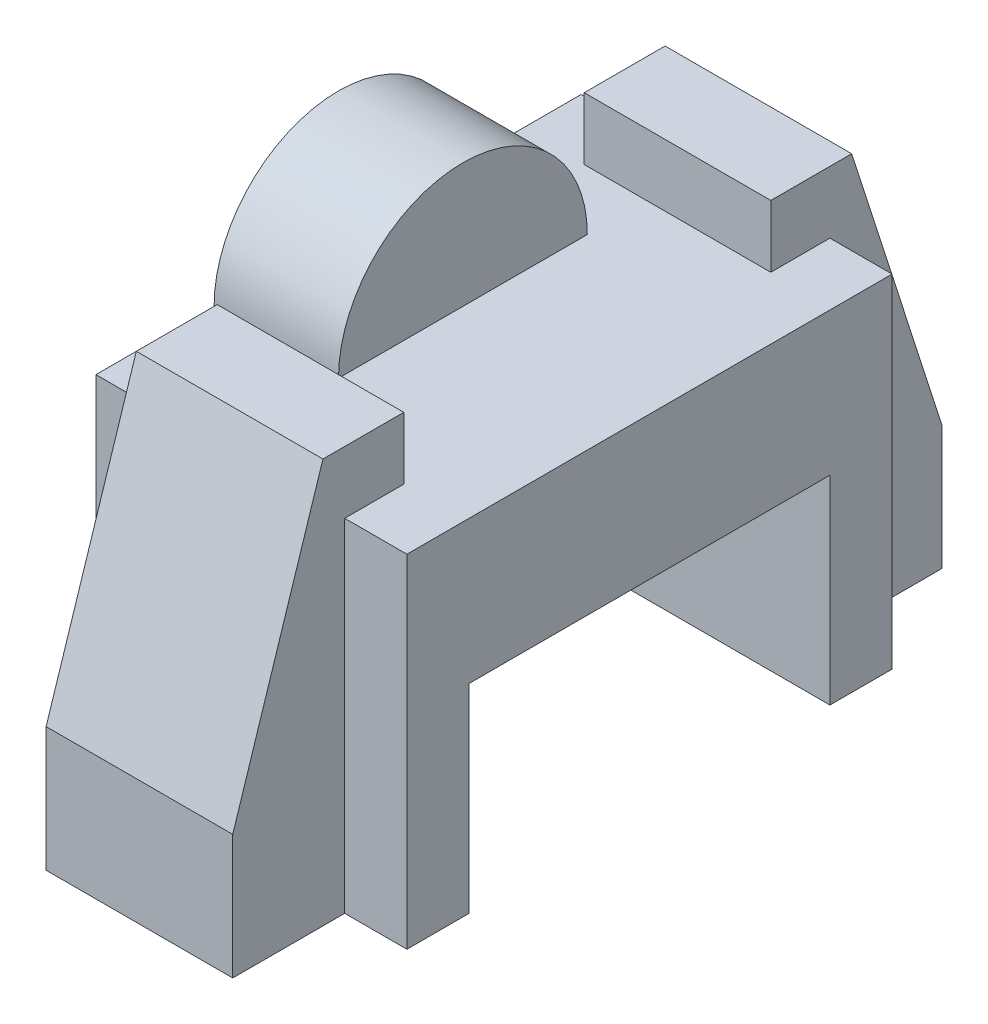
from build123d import *

# Parameters (mm, degrees)
SALIENTE_EXTRUIR2_DEPTH = 25
SALIENTE_EXTRUIR3_DEPTH = 15
SALIENTE_EXTRUIR4_START = -50
SALIENTE_EXTRUIR4_DEPTH = 20


with BuildPart() as part:
    # Croquis1 → Saliente-Extruir2 (new, symmetric)
    with BuildSketch(Plane(origin=(0, 0, 0), x_dir=(0, 0, -1), z_dir=(1, 0, 0))):
        Polygon((29, -27.5), (39, -27.5), (39, 27.5), (-39, 27.5), (-39, -27.5), (-29, -27.5), (-29, 4.5), (29, 4.5), align=None)
    extrude(amount=SALIENTE_EXTRUIR2_DEPTH, both=True)

    # Croquis3 → Saliente-Extruir3 (add, symmetric)
    with BuildSketch(Plane(origin=(0, 0, 0), x_dir=(0, 0, -1), z_dir=(1, 0, 0))):
        Polygon((-39, 27.5), (-29.5, 27.5), (-29.5, 37.5), (-42.5, 37.5), (-57, -7.5), (-57, -27.5), (-39, -27.5), align=None)
        Polygon((42.5, 37.5), (57, -7.5), (57, -27.5), (39, -27.5), (39, 27.5), (29.5, 27.5), (29.5, 37.5), align=None)
    extrude(amount=SALIENTE_EXTRUIR3_DEPTH, both=True)

    # Croquis4 → Saliente-Extruir4 (add)
    with BuildSketch(Plane(origin=(25, 0, 0), x_dir=(0, 0, -1), z_dir=(1, 0, 0)).offset(SALIENTE_EXTRUIR4_START)):
        with BuildLine():
            Line((-20, 27.5), (20, 27.5))
            ThreePointArc((20, 27.5), (0, 47.5), (-20, 27.5))
        make_face()
    extrude(amount=SALIENTE_EXTRUIR4_DEPTH)


solid = part.part
